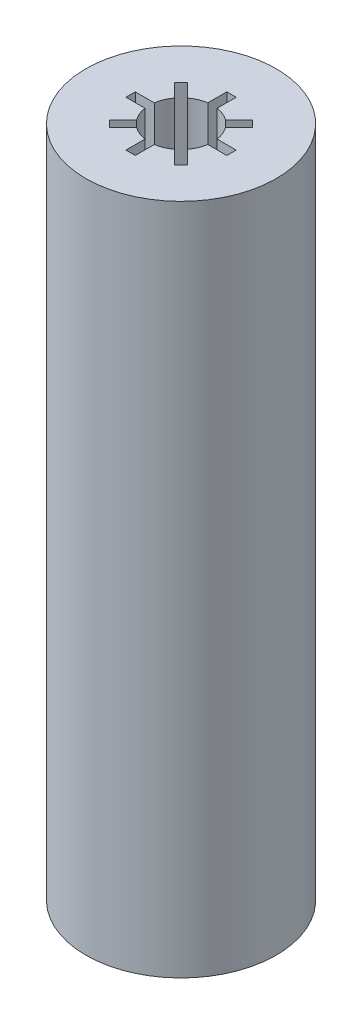
from build123d import *

# Parameters (mm, degrees)
SKETCH1_R           = 64.7065
SKETCH1_R_2         = 21.59
BOSS_EXTRUDE1_DEPTH = 457.2
CUT_EXTRUDE1_REACH  = 468.268
CIRPATTERN1_COUNT   = 8


with BuildPart() as part:
    # Sketch1 → Boss-Extrude1 (new body)
    with BuildSketch(Plane(origin=(0, 0, 0), x_dir=(1, 0, 0), z_dir=(0, 1, 0))):
        with Locations(Location((0, 0, 0), (0, 0, 270))):
            Circle(SKETCH1_R)
        with Locations(Location((0, 0, 0), (0, 0, 270))):
            Circle(SKETCH1_R_2, mode=Mode.SUBTRACT)
    extrude(amount=BOSS_EXTRUDE1_DEPTH)

    # Sketch2 → Cut-Extrude1 (cut, up to next)
    with BuildSketch(Plane(origin=(0, 457.2, 0), x_dir=(1, 0, 0), z_dir=(0, 1, 0)), mode=Mode.PRIVATE) as cut_extrude1_sk1:
        with BuildLine():
            Line((-3.175, 34.29), (3.175, 34.29))
            Line((3.175, 34.29), (3.175, 21.355268085))
            ThreePointArc((3.175, 21.355268085), (0, 21.59), (-3.175, 21.355268085))
            Line((-3.175, 21.355268085), (-3.175, 34.29))
        make_face()
    cut_extrude1_tool1 = extrude(cut_extrude1_sk1.sketch, amount=-CUT_EXTRUDE1_REACH, mode=Mode.PRIVATE) & part.part
    cut_extrude1 = cut_extrude1_tool1.solids().sort_by_distance((0, 457.2, -27.900772))[0]
    add(cut_extrude1, mode=Mode.SUBTRACT)

    # CirPattern1: Cut-Extrude1 ×8 about axis
    cirpattern1_axis = Axis((0, 0, 0), (0, 1, 0))
    for i in range(1, CIRPATTERN1_COUNT):
        add(cut_extrude1.rotate(cirpattern1_axis, i * 360 / CIRPATTERN1_COUNT), mode=Mode.SUBTRACT)


solid = part.part
